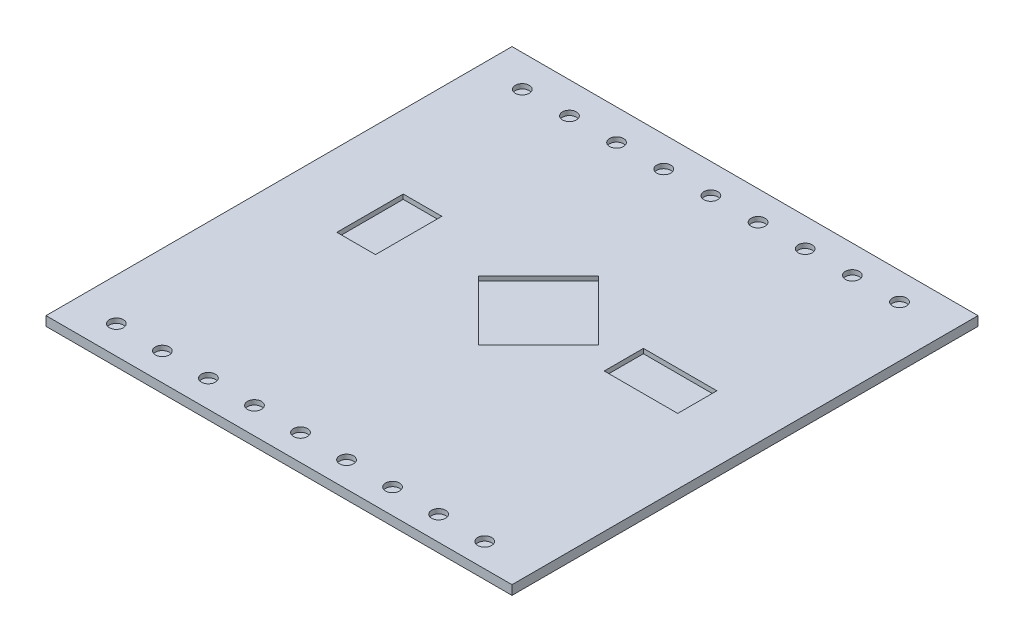
from build123d import *

# Parameters (mm, degrees)
SKETCH1_W           = 10
SKETCH1_H           = 0.2
BOSS_EXTRUDE1_DEPTH = 10
SKETCH2_R           = 0.150013962
SKETCH2_W           = 0.829232584
SKETCH2_H           = 1.424301619
SKETCH2_W_2         = 1.576755533
SKETCH2_H_2         = 0.841304981
CUT_EXTRUDE1_DEPTH  = 0.1


with BuildPart() as part:
    # Sketch1 → Boss-Extrude1 (new body)
    with BuildSketch(Plane.XY):
        Rectangle(SKETCH1_W, SKETCH1_H)
    extrude(amount=BOSS_EXTRUDE1_DEPTH)

    # Sketch2 → Cut-Extrude1 (cut)
    with BuildSketch(Plane(origin=(0, 0.1, 0), x_dir=(1, 0, 0), z_dir=(0, 1, 0))):
        with Locations(Location((3.903958112, -0.58843737, 0), (0, 0, 180))):
            Circle(SKETCH2_R)
        with Locations(Location((2.904028968, -0.600341426, 0), (0, 0, 180))):
            Circle(SKETCH2_R)
        with Locations(Location((1.904099824, -0.612245481, 0), (0, 0, 180))):
            Circle(SKETCH2_R)
        with Locations(Location((0.904170679, -0.624149537, 0), (0, 0, 180))):
            Circle(SKETCH2_R)
        with Locations(Location((-0.095758465, -0.636053593, 0), (0, 0, 180))):
            Circle(SKETCH2_R)
        with Locations(Location((-1.095687609, -0.647957649, 0), (0, 0, 180))):
            Circle(SKETCH2_R)
        with Locations(Location((-2.095616753, -0.659861704, 0), (0, 0, 180))):
            Circle(SKETCH2_R)
        with Locations(Location((-3.095545897, -0.67176576, 0), (0, 0, 180))):
            Circle(SKETCH2_R)
        with Locations(Location((-4.095475042, -0.683669816, 0), (0, 0, 180))):
            Circle(SKETCH2_R)
        with Locations((-4.095475042, -9.395473292)):
            Circle(SKETCH2_R)
        with Locations((-3.095545897, -9.407377347)):
            Circle(SKETCH2_R)
        with Locations((-2.095616753, -9.419281403)):
            Circle(SKETCH2_R)
        with Locations((-1.095687609, -9.431185459)):
            Circle(SKETCH2_R)
        with Locations((0.904170679, -9.45499357)):
            Circle(SKETCH2_R)
        with Locations((-0.095758465, -9.443089515)):
            Circle(SKETCH2_R)
        with Locations((1.904099824, -9.466897626)):
            Circle(SKETCH2_R)
        with Locations((2.904028968, -9.478801682)):
            Circle(SKETCH2_R)
        with Locations((3.903958112, -9.490705738)):
            Circle(SKETCH2_R)
        Polygon((1.476108968, -4.618919063), (0.189761323, -3.332571418), (-1.096586323, -4.618919063), (0.189761323, -5.905266709), align=None)
        with Locations((-3.012916665, -4.618919063)):
            Rectangle(SKETCH2_W, SKETCH2_H)
        with Locations((2.806863526, -4.618919063)):
            Rectangle(SKETCH2_W_2, SKETCH2_H_2)
    extrude(amount=-CUT_EXTRUDE1_DEPTH, mode=Mode.SUBTRACT)


solid = part.part
